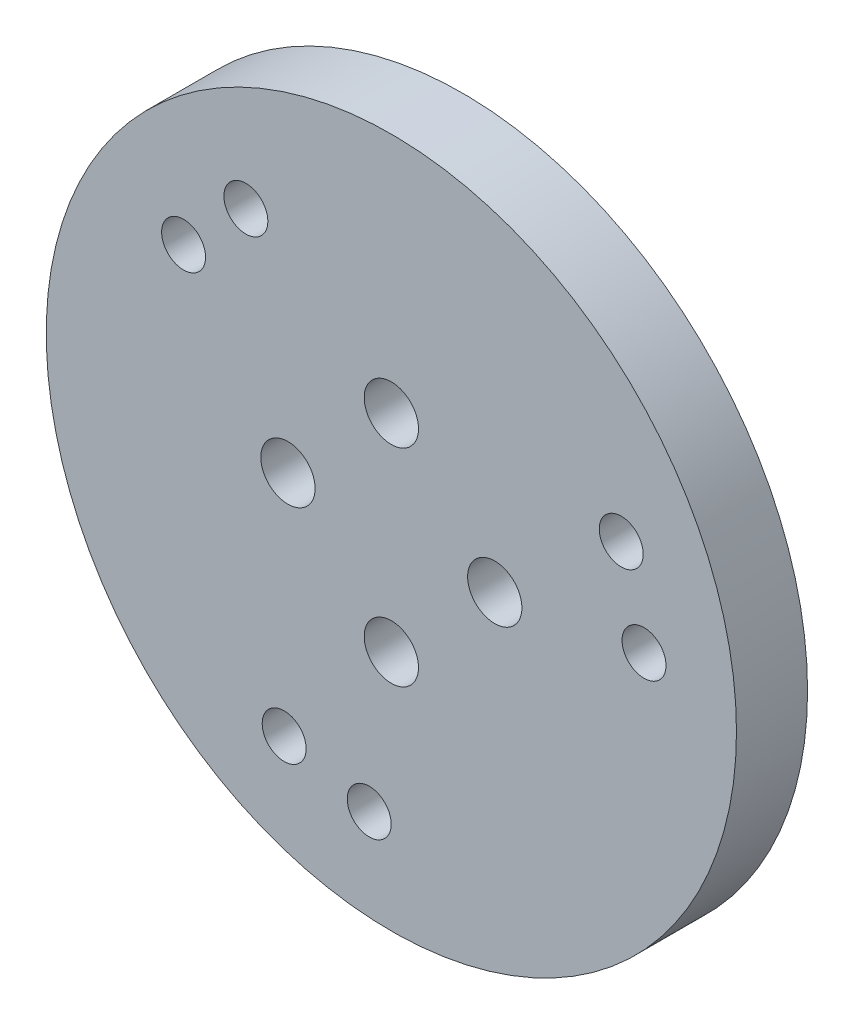
from build123d import *

# Parameters (mm, degrees)
SKETCH_1_R               = 15
SKETCH_1_R_2             = 2.3
SKETCH_1_R_3             = 1.1
EXTRUDE_1_DEPTH          = 7
CUT_EXTRUDE_1_DEPTH      = 10
CUT_EXTRUDE_1_DEPTH_BACK = 2
SKETCH_2_R               = 2.1
SKETCH_10_R              = 10
CUT_EXTRUDE_7_DEPTH      = 1.6
SKETCH_9_R               = 4.2
CUT_EXTRUDE_5_DEPTH      = 22.889723616
SKETCH_11_R              = 26.7
SKETCH_11_R_2            = 1.7
EXTRUDE_2_DEPTH          = 5.5
SKETCH_13_R              = 3
CUT_EXTRUDE_9_DEPTH      = 2.5
CUT_EXTRUDE_START        = -8
SKETCH_14_R              = 2.1
CUT_EXTRUDE_10_DEPTH     = 8


with BuildPart() as part:
    # 스케치1 → 보스-돌출1 (new body)
    with BuildSketch(Plane.XY):
        Circle(SKETCH_1_R)
        Circle(SKETCH_1_R_2, mode=Mode.SUBTRACT)
        with Locations((0, 8)):
            Circle(SKETCH_1_R_3, mode=Mode.SUBTRACT)
        with Locations((8, 0)):
            Circle(SKETCH_1_R_3, mode=Mode.SUBTRACT)
        with Locations((0, -8)):
            Circle(SKETCH_1_R_3, mode=Mode.SUBTRACT)
        with Locations((-8, 0)):
            Circle(SKETCH_1_R_3, mode=Mode.SUBTRACT)
    extrude(amount=EXTRUDE_1_DEPTH)

    # 스케치2 → 컷-돌출1 (cut, two sides: drawn at the far end of the back side and taken through both)
    with BuildSketch(Plane.XY.offset(7).offset(-CUT_EXTRUDE_1_DEPTH_BACK)):
        with Locations((0, 8)):
            Circle(SKETCH_2_R)
        with Locations((8, 0)):
            Circle(SKETCH_2_R)
        with Locations((0, -8)):
            Circle(SKETCH_2_R)
        with Locations((-8, 0)):
            Circle(SKETCH_2_R)
    extrude(amount=CUT_EXTRUDE_1_DEPTH + CUT_EXTRUDE_1_DEPTH_BACK, mode=Mode.SUBTRACT)

    # 스케치10 → 컷-돌출7 (cut)
    with BuildSketch(Plane(origin=(0, 0, 0), x_dir=(-1, 0, 0), z_dir=(0, 0, -1))):
        Circle(SKETCH_10_R)
    extrude(amount=-CUT_EXTRUDE_7_DEPTH, mode=Mode.SUBTRACT)

    # 스케치9 → 컷-돌출5 (cut, through all)
    with BuildSketch(Plane(origin=(0, 0, 1.6), x_dir=(-1, 0, 0), z_dir=(0, 0, -1))):
        Circle(SKETCH_9_R)
    extrude(amount=-CUT_EXTRUDE_5_DEPTH, mode=Mode.SUBTRACT)

    # 스케치11 → 보스-돌출2 (add)
    with BuildSketch(Plane.XY.offset(7)):
        Circle(SKETCH_11_R)
        with Locations((-11.254716834, 16.073401413)):
            Circle(SKETCH_11_R_2, mode=Mode.SUBTRACT)
        with Locations((-16.073401413, 11.254716834)):
            Circle(SKETCH_11_R_2, mode=Mode.SUBTRACT)
        with Locations((19.547332366, 1.710169984)):
            Circle(SKETCH_11_R_2, mode=Mode.SUBTRACT)
        with Locations((17.783571397, 8.292615532)):
            Circle(SKETCH_11_R_2, mode=Mode.SUBTRACT)
        with Locations((-8.292615532, -17.783571397)):
            Circle(SKETCH_11_R_2, mode=Mode.SUBTRACT)
        with Locations((-1.710169984, -19.547332366)):
            Circle(SKETCH_11_R_2, mode=Mode.SUBTRACT)
    extrude(amount=EXTRUDE_2_DEPTH)

    # 스케치13 → 컷-돌출9 (cut)
    with BuildSketch(Plane(origin=(0, 0, 7), x_dir=(-1, 0, 0), z_dir=(0, 0, -1))):
        with Locations((-17.783571397, 8.292615532)):
            Circle(SKETCH_13_R)
        with Locations((-19.547332366, 1.710169984)):
            Circle(SKETCH_13_R)
        with Locations((11.254716834, 16.073401413)):
            Circle(SKETCH_13_R)
        with Locations((16.073401413, 11.254716834)):
            Circle(SKETCH_13_R)
        with Locations((1.710169984, -19.547332366)):
            Circle(SKETCH_13_R)
        with Locations((8.292615532, -17.783571397)):
            Circle(SKETCH_13_R)
    extrude(amount=-CUT_EXTRUDE_9_DEPTH, mode=Mode.SUBTRACT)

    # 스케치14 → 컷-돌출10 (cut)
    with BuildSketch(Plane(origin=(0, 0, 7), x_dir=(-1, 0, 0), z_dir=(0, 0, -1)).offset(CUT_EXTRUDE_START)):
        with Locations(Location((8, 0, 0), (0, 0, 180))):
            Circle(SKETCH_14_R)
        with Locations(Location((0, -8, 0), (0, 0, 180))):
            Circle(SKETCH_14_R)
        with Locations(Location((-8, 0, 0), (0, 0, 180))):
            Circle(SKETCH_14_R)
        with Locations(Location((0, 8, 0), (0, 0, 180))):
            Circle(SKETCH_14_R)
    extrude(amount=CUT_EXTRUDE_10_DEPTH, mode=Mode.SUBTRACT)


solid = part.part
